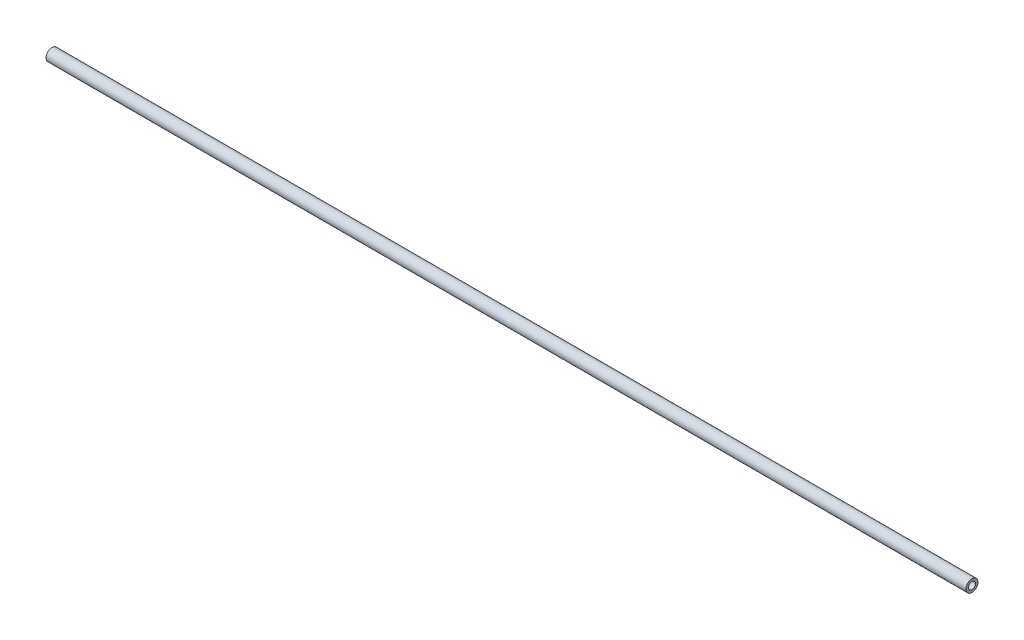
from build123d import *

# Parameters (mm, degrees)
SKETCH1_R      = 1.984375
SKETCH1_R_2    = 1.190625
EXTRUDE1_DEPTH = 152.4


with BuildPart() as part:
    # Sketch1 → Extrude1 (new, symmetric)
    with BuildSketch(Plane(origin=(0, 0, 0), x_dir=(0, 0, -1), z_dir=(1, 0, 0))):
        with Locations(Location((0, 0, 0), (0, 0, 180))):
            Circle(SKETCH1_R)
        with Locations(Location((0, 0, 0), (0, 0, 180))):
            Circle(SKETCH1_R_2, mode=Mode.SUBTRACT)
    extrude(amount=EXTRUDE1_DEPTH, both=True)


solid = part.part
